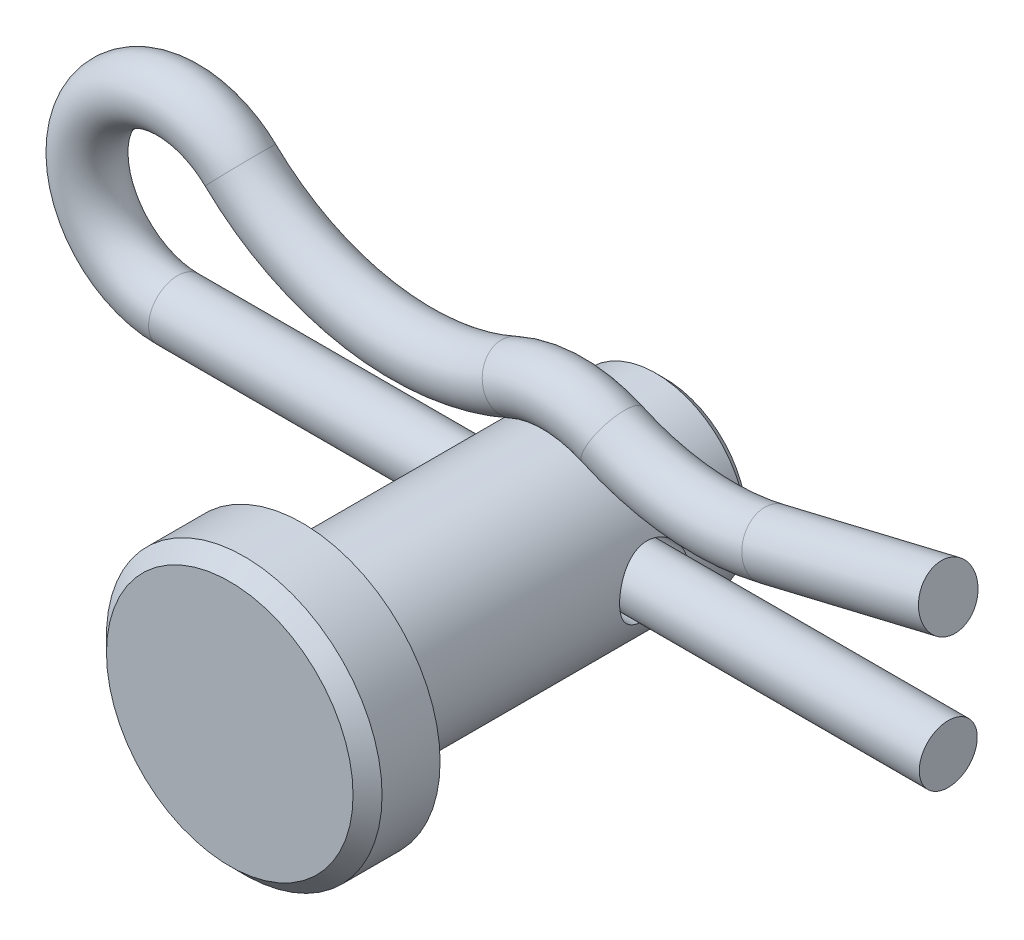
from build123d import *

# Parameters (mm, degrees)
SKETCH1_R           = 3.175
EXTRUDE1_DEPTH      = 6.35
SKETCH2_R           = 4.826
EXTRUDE2_DEPTH      = 2.54
CHAMFER1_SIZE       = 0.508
EXTRUDE3_DEPTH      = 12.207705028
EXTRUDE3_DEPTH_BACK = 12.207705028
SKETCH3_R           = 1.190625
CHAMFER2_SIZE       = 0.3175
SKETCH7_R           = 1.016


with BuildPart() as part:
    # Sketch1 → Extrude1 (new, symmetric)
    with BuildSketch(Plane.XY):
        Circle(SKETCH1_R)
    extrude(amount=EXTRUDE1_DEPTH, both=True)

    # Sketch2 → Extrude2 (add)
    with BuildSketch(Plane.XY.offset(6.35)):
        Circle(SKETCH2_R)
    extrude(amount=EXTRUDE2_DEPTH)

    # Chamfer1
    chamfer1_edges = [part.edges().sort_by_distance(p)[0] for p in [
        (-4.826, 0, 8.89),
    ]]
    chamfer(chamfer1_edges, length=CHAMFER1_SIZE)

    # Sketch3 → Extrude3 (cut, two sides: drawn at the far end of the back side and taken through both)
    with BuildSketch(Plane(origin=(0, 0, 0), x_dir=(0, 0, -1), z_dir=(1, 0, 0)).offset(-EXTRUDE3_DEPTH_BACK)):
        with Locations(Location((2.778125, 0, 0), (0, 0, 179.999999999))):
            Circle(SKETCH3_R)
    extrude(amount=EXTRUDE3_DEPTH + EXTRUDE3_DEPTH_BACK, mode=Mode.SUBTRACT)

    # Chamfer2
    chamfer2_edges = [part.edges().sort_by_distance(p)[0] for p in [
        (-3.175, 0, -6.35),
    ]]
    chamfer(chamfer2_edges, length=CHAMFER2_SIZE)


with BuildPart() as body_2:
    # Sweep1: sweep along a path in Sketch6
    with BuildLine(Plane.XY.offset(-2.778125)) as sweep1_path:
        Line((13.49375, 0), (-13.49375, 0))
        ThreePointArc((-13.49375, 0), (-16.438801729, 4.361294783), (-11.292994408, 5.463514764))
        ThreePointArc((-11.292994408, 5.463514764), (-6.763179694, 3.173261299), (-1.728419774, 3.817989796))
        ThreePointArc((-1.728419774, 3.817989796), (0, 4.191), (1.728419774, 3.817989796))
        ThreePointArc((1.728419774, 3.817989796), (4.472851559, 3.087280395), (7.306026778, 3.28466386))
        Line((7.306026778, 3.28466386), (13.49375, 4.7625))
    # Sketch7 → Sweep1 (sweep)
    with BuildSketch(Plane(origin=(13.49375, 0, -2.778125), x_dir=(0, 0, 1), z_dir=(-1, 0, 0))):
        Circle(SKETCH7_R)
    sweep(path=sweep1_path.line)


solid = Compound([part.part, body_2.part])
